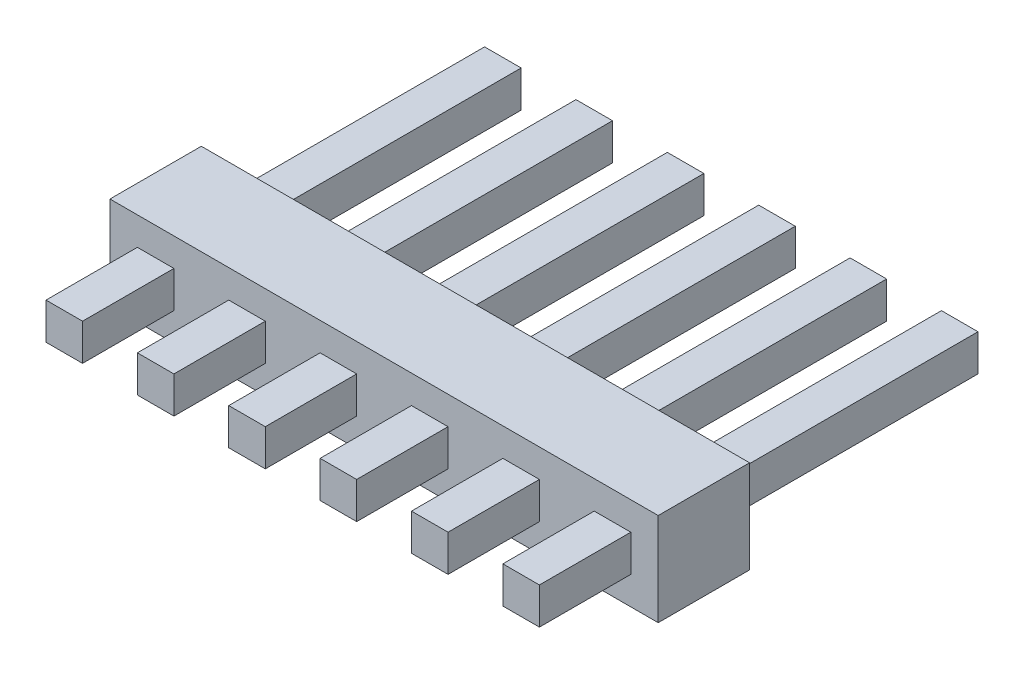
from build123d import *

# Parameters (mm, degrees)
SKETCH_1_W           = 15
SKETCH_1_H           = 2.54
EXTRUDE_1_DEPTH      = 2.5
EXTRUDE_2_DEPTH      = 7
EXTRUDE_2_DEPTH_BACK = 5
SKETCH_2_W           = 1
SKETCH_2_H           = 1


with BuildPart() as part:
    # Эскиз1 → Бобышка-Вытянуть1 (new body)
    with BuildSketch(Plane.XY):
        Rectangle(SKETCH_1_W, SKETCH_1_H)
    extrude(amount=EXTRUDE_1_DEPTH)

    # Эскиз2 → Бобышка-Вытянуть2 (add, two sides: drawn at the far end of the back side and taken through both)
    with BuildSketch(Plane(origin=(0, 0, 0), x_dir=(-1, 0, 0), z_dir=(0, 0, -1)).offset(-EXTRUDE_2_DEPTH_BACK)):
        with Locations((-3.75, 0)):
            Rectangle(SKETCH_2_W, SKETCH_2_H)
        with Locations((-6.25, 0)):
            Rectangle(SKETCH_2_W, SKETCH_2_H)
        with Locations((-1.25, 0)):
            Rectangle(SKETCH_2_W, SKETCH_2_H)
        with Locations((1.25, 0)):
            Rectangle(SKETCH_2_W, SKETCH_2_H)
        with Locations((3.75, 0)):
            Rectangle(SKETCH_2_W, SKETCH_2_H)
        with Locations((6.25, 0)):
            Rectangle(SKETCH_2_W, SKETCH_2_H)
    extrude(amount=EXTRUDE_2_DEPTH + EXTRUDE_2_DEPTH_BACK)


solid = part.part
